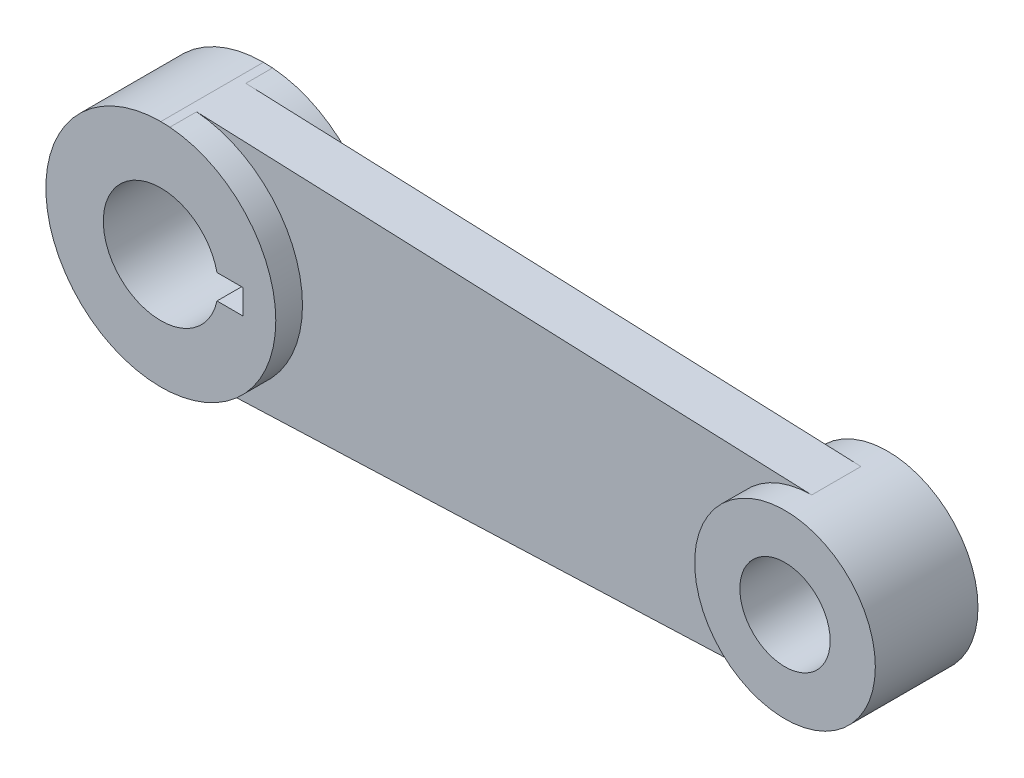
from build123d import *
from build123d.topology import SkipClean

# Parameters (mm, degrees)
SKETCH4_R           = 5.5
BOSS_EXTRUDE3_DEPTH = 6.25
CUT_EXTRUDE1_DEPTH  = 3.25


with BuildPart() as part:
    # Sketch4 → Boss-Extrude3 (new, symmetric)
    with BuildSketch(Plane.XY):
        with BuildLine():
            ThreePointArc((0, 14), (-14, 0), (0, -14))
            Line((0, -14), (76, -11))
            ThreePointArc((76, -11), (87, 0), (76, 11))
            Line((76, 11), (0, 14))
        make_face()
        with BuildLine():
            ThreePointArc((6.837397166, -1.5), (-7, 0), (6.837397166, 1.5))
            Line((6.837397166, 1.5), (10, 1.5))
            Line((10, 1.5), (10, -1.5))
            Line((10, -1.5), (6.837397166, -1.5))
        make_face(mode=Mode.SUBTRACT)
        with Locations((76, 0)):
            Circle(SKETCH4_R, mode=Mode.SUBTRACT)
    extrude(amount=BOSS_EXTRUDE3_DEPTH, both=True)

    # Sketch5 → Cut-Extrude1 (cut)
    with SkipClean():  # the faces are left unmerged after this step: merging them gives an invalid solid
        with BuildSketch(Plane.XY.offset(6.25)):
            with BuildLine():
                Line((76, 11), (1.103543647, 13.956439067))
                ThreePointArc((1.103543647, 13.956439067), (14, 0), (1.103543647, -13.956439067))
                Line((1.103543647, -13.956439067), (76, -11))
                ThreePointArc((76, -11), (65, 0), (76, 11))
            make_face()
        cut_extrude1 = extrude(amount=-CUT_EXTRUDE1_DEPTH, mode=Mode.SUBTRACT)

    # Mirror1: Cut-Extrude1 across plane
    with SkipClean():  # the faces are left unmerged after this step: merging them gives an invalid solid
        add(cut_extrude1.mirror(Plane.XY), mode=Mode.SUBTRACT)


solid = part.part
